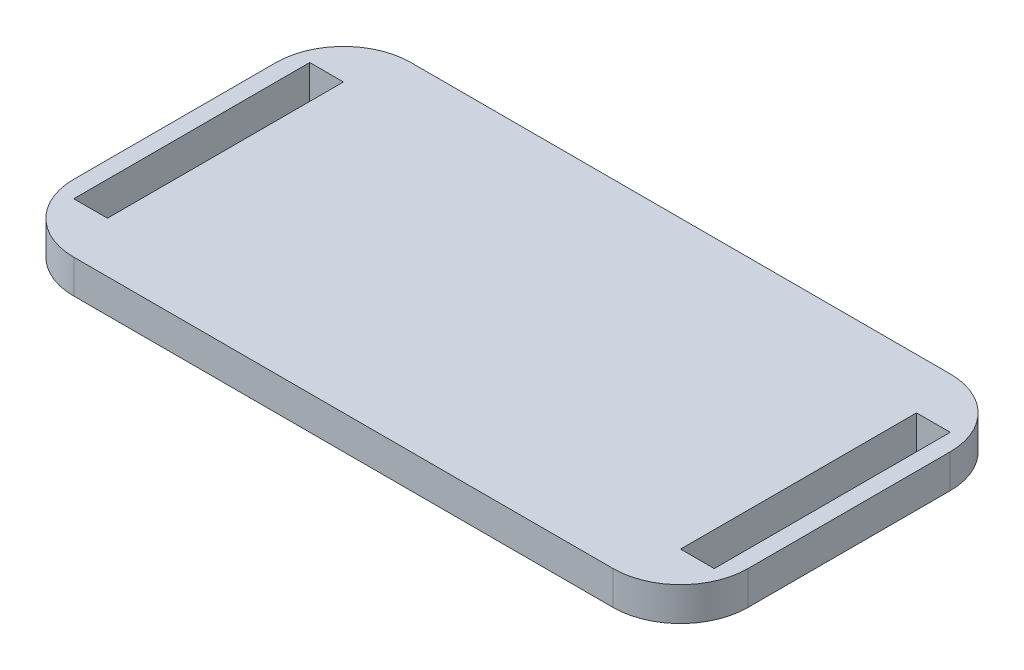
from build123d import *

# Parameters (mm, degrees)
CROQUIS1_W              = 5
CROQUIS1_H              = 35
SALIENTE_EXTRUIR2_DEPTH = 5


with BuildPart() as part:
    # Croquis1 → Saliente-Extruir2 (new body)
    with BuildSketch(Plane(origin=(0, 0, 0), x_dir=(1, 0, 0), z_dir=(0, 1, 0))):
        with BuildLine():
            Line((-40, -25), (40, -25))
            ThreePointArc((40, -25), (47.071067812, -22.071067812), (50, -15))
            Line((50, -15), (50, 15))
            ThreePointArc((50, 15), (47.071067812, 22.071067812), (40, 25))
            Line((40, 25), (-40, 25))
            ThreePointArc((-40, 25), (-47.071067812, 22.071067812), (-50, 15))
            Line((-50, 15), (-50, -15))
            ThreePointArc((-50, -15), (-47.071067812, -22.071067812), (-40, -25))
        make_face()
        with Locations((-45, 0)):
            Rectangle(CROQUIS1_W, CROQUIS1_H, mode=Mode.SUBTRACT)
        with Locations((45, 0)):
            Rectangle(CROQUIS1_W, CROQUIS1_H, mode=Mode.SUBTRACT)
    extrude(amount=SALIENTE_EXTRUIR2_DEPTH)


solid = part.part
